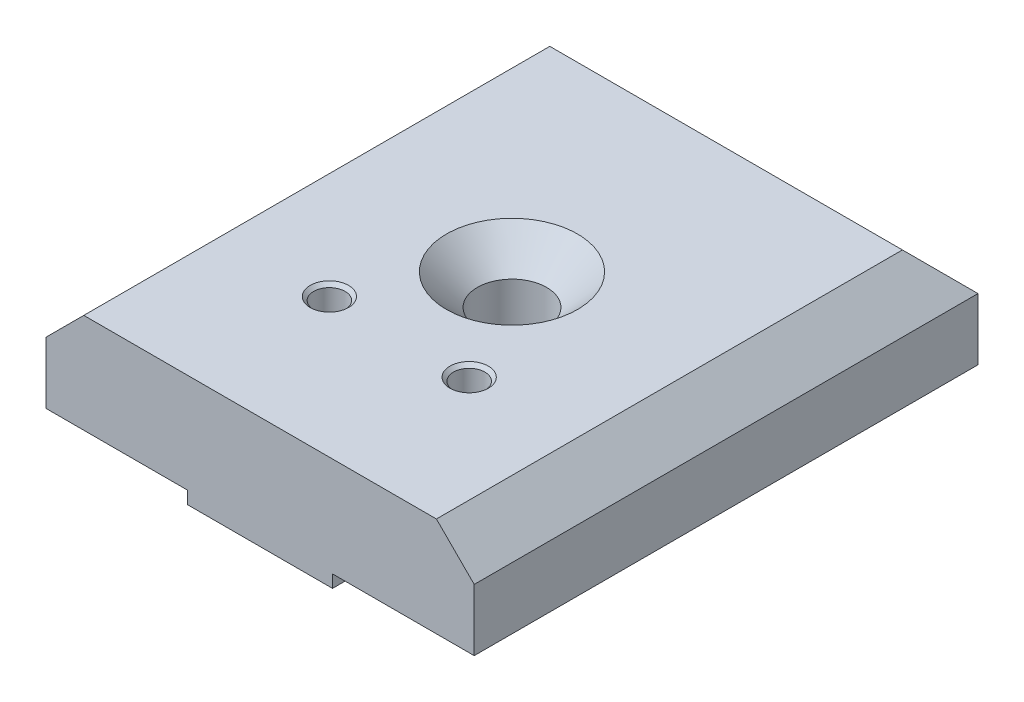
from build123d import *

# Parameters (mm, degrees)
SKETCH_1_W                    = 34
SKETCH_1_H                    = 40
EXTRUDE_326_DEPTH             = 7.9
HOLE_WIZARD_40_M5_D           = 5.5
HOLE_WIZARD_40_M5_CSINK_D     = 10.4
HOLE_WIZARD_40_M5_CSINK_ANGLE = 90
HOLE_WIZARD_M3_D              = 2.5
HOLE_WIZARD_M3_CSINK_D        = 3.05
HOLE_WIZARD_M3_CSINK_ANGLE    = 90
CHAMFER_1_SIZE                = 3
SKETCH_7_W                    = 11.5
SKETCH_7_H                    = 40
EXTRUDE_40_DEPTH              = 1


with BuildPart() as part:
    # Эскиз1 → Extrude 326 (new body)
    with BuildSketch(Plane(origin=(0, 0, 0), x_dir=(1, 0, 0), z_dir=(0, 1, 0))):
        Rectangle(SKETCH_1_W, SKETCH_1_H)
    extrude(amount=EXTRUDE_326_DEPTH)

    # Крепление к профилю 40 - M5 (through all)
    with Locations(Plane(origin=(0, 7.9, 0), x_dir=(-1, 0, 0), z_dir=(0, 1, 0))):
        with Locations((0, 0)):
            CounterSinkHole(HOLE_WIZARD_40_M5_D / 2, HOLE_WIZARD_40_M5_CSINK_D / 2, counter_sink_angle=HOLE_WIZARD_40_M5_CSINK_ANGLE)

    # Крепление датчика M3 (through all)
    with Locations(Plane(origin=(0, 7.9, 0), x_dir=(-1, 0, 0), z_dir=(0, 1, 0))):
        with Locations((5.55, 8.95), (-5.55, 8.95)):
            CounterSinkHole(HOLE_WIZARD_M3_D / 2, HOLE_WIZARD_M3_CSINK_D / 2, counter_sink_angle=HOLE_WIZARD_M3_CSINK_ANGLE)

    # Фаска1
    chamfer_1_edges = [part.edges().sort_by_distance(p)[0] for p in [
        (-17, 7.9, 0),
        (17, 7.9, 0),
        (0, 7.9, -20),
    ]]
    chamfer(chamfer_1_edges, length=CHAMFER_1_SIZE)

    # Эскиз7 → Направляющая профиля 40 (add)
    with BuildSketch(Plane.XZ):
        Rectangle(SKETCH_7_W, SKETCH_7_H)
    extrude(amount=EXTRUDE_40_DEPTH)


solid = part.part
